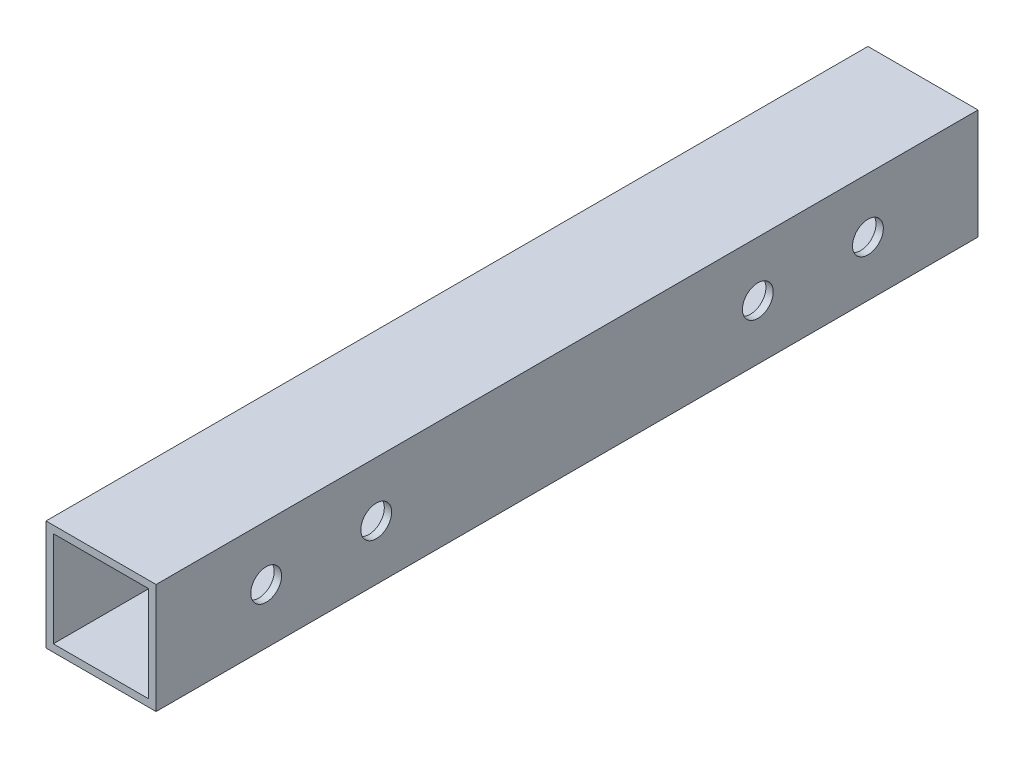
from build123d import *

# Parameters (mm, degrees)
SKETCH_1_W          = 15
SKETCH_1_H          = 15
SKETCH_1_W_2        = 13
SKETCH_1_H_2        = 13
EXTRUDE_1_DEPTH     = 112
SKETCH_3_R          = 2.1
CUT_EXTRUDE_1_DEPTH = 55


with BuildPart() as part:
    # 草图1 → 凸台-拉伸1 (new body)
    with BuildSketch(Plane.XY):
        Rectangle(SKETCH_1_W, SKETCH_1_H)
        Rectangle(SKETCH_1_W_2, SKETCH_1_H_2, mode=Mode.SUBTRACT)
    extrude(amount=EXTRUDE_1_DEPTH)

    # 草图3 → 切除-拉伸1 (cut)
    with BuildSketch(Plane(origin=(7.5, 0, 0), x_dir=(0, 0, -1), z_dir=(1, 0, 0))):
        with Locations((-15, 0)):
            Circle(SKETCH_3_R)
        with Locations((-30, 0)):
            Circle(SKETCH_3_R)
        with Locations((-97, 0)):
            Circle(SKETCH_3_R)
        with Locations((-82, 0)):
            Circle(SKETCH_3_R)
    extrude(amount=-CUT_EXTRUDE_1_DEPTH, mode=Mode.SUBTRACT)


solid = part.part
